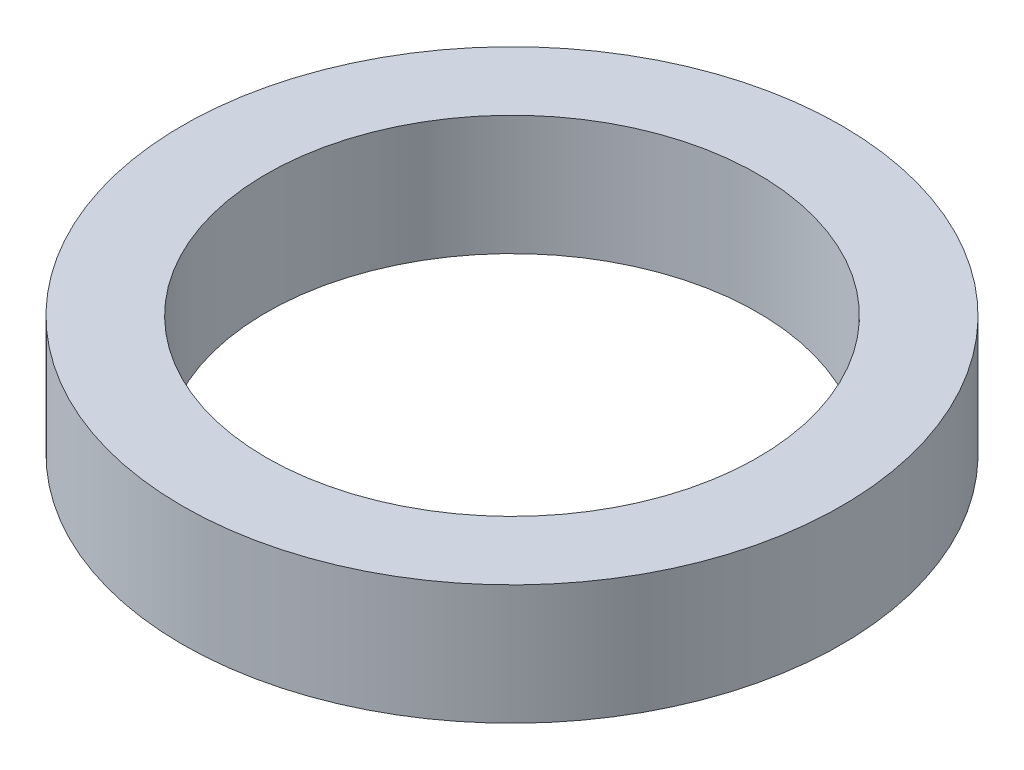
from build123d import *

# Parameters (mm, degrees)
SKETCH1_R           = 2.75
SKETCH1_R_2         = 2.05
BOSS_EXTRUDE1_DEPTH = 1


with BuildPart() as part:
    # Sketch1 → Boss-Extrude1 (new body)
    with BuildSketch(Plane(origin=(0, 0, 0), x_dir=(1, 0, 0), z_dir=(0, 1, 0))):
        with Locations(Location((0, 0, 0), (0, 0, 270))):
            Circle(SKETCH1_R)
        with Locations(Location((0, 0, 0), (0, 0, 270))):
            Circle(SKETCH1_R_2, mode=Mode.SUBTRACT)
    extrude(amount=BOSS_EXTRUDE1_DEPTH)


solid = part.part
